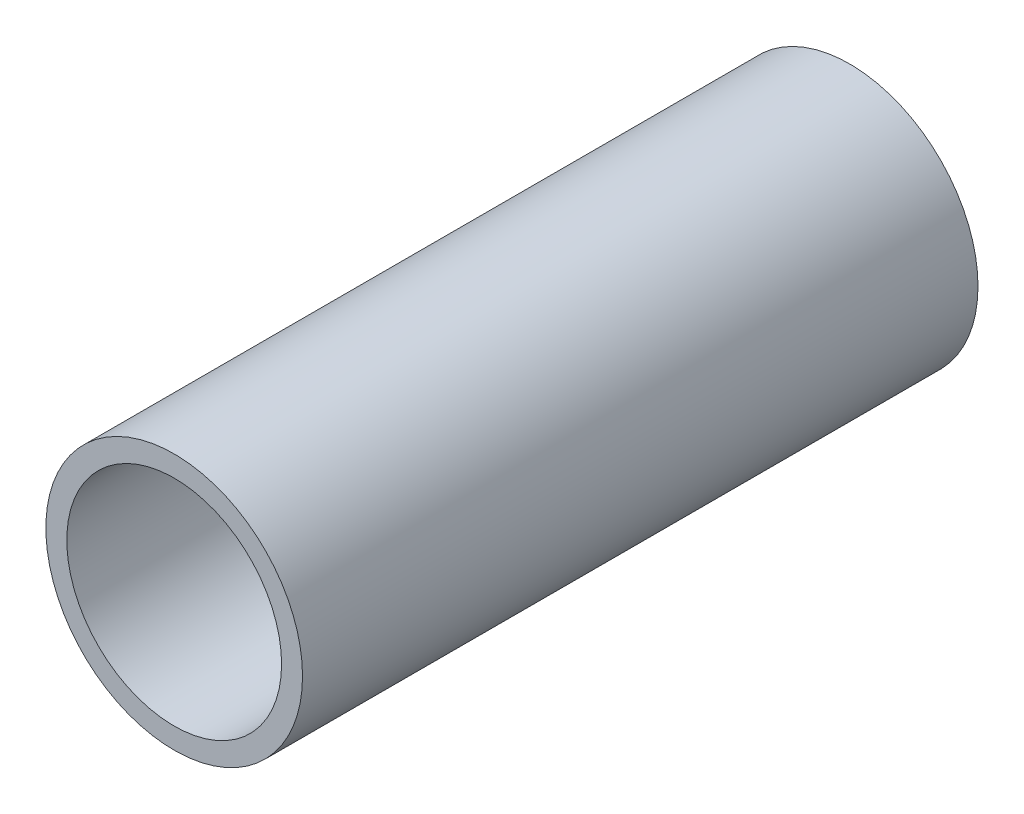
from build123d import *

# Parameters (mm, degrees)
SKETCH1_R           = 24.13
SKETCH1_R_2         = 20.193
BOSS_EXTRUDE1_DEPTH = 127


with BuildPart() as part:
    # Sketch1 → Boss-Extrude1 (new body)
    with BuildSketch(Plane.XY):
        Circle(SKETCH1_R)
        Circle(SKETCH1_R_2, mode=Mode.SUBTRACT)
    extrude(amount=BOSS_EXTRUDE1_DEPTH)


solid = part.part
